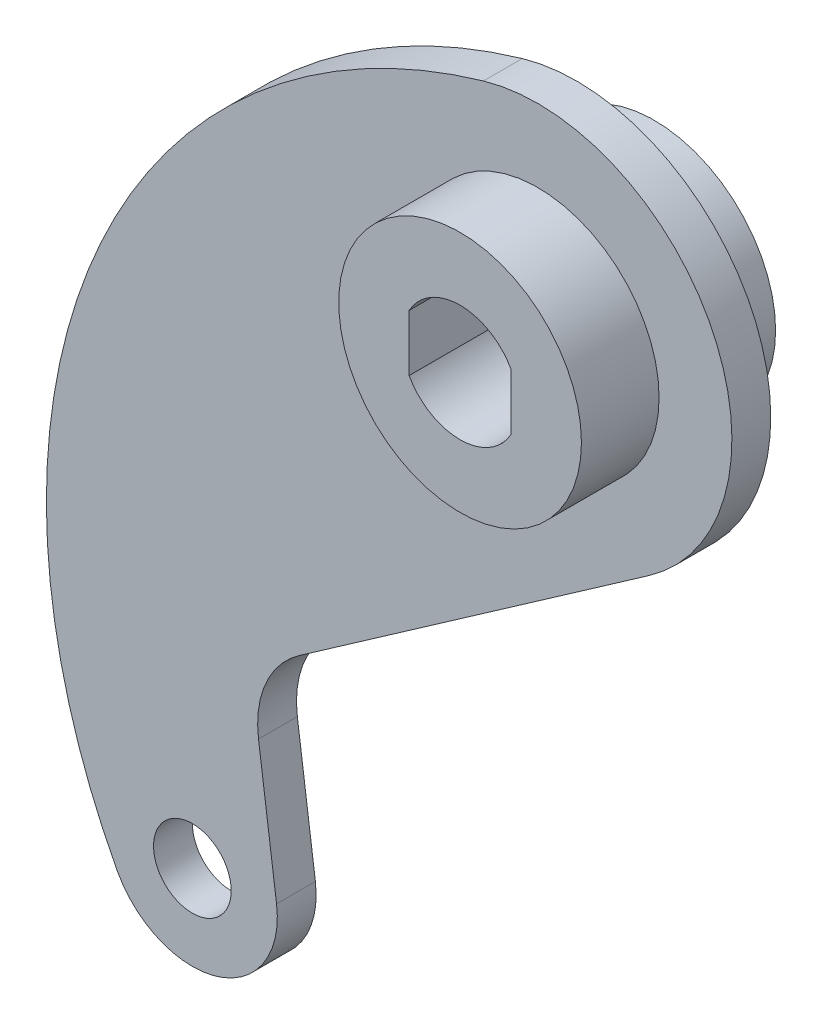
from build123d import *

# Parameters (mm, degrees)
SKETCH1_R           = 25
SKETCH1_R_2         = 12
BOSS_EXTRUDE1_DEPTH = 40
SKETCH3_R           = 25
SKETCH3_R_2         = 8
BOSS_EXTRUDE2_DEPTH = 8
FILLET1_R           = 20
BOSS_EXTRUDE3_START = -40
BOSS_EXTRUDE3_DEPTH = 40


with BuildPart() as part:
    # Sketch1 → Boss-Extrude1 (new body)
    with BuildSketch(Plane.XY):
        Circle(SKETCH1_R)
        Circle(SKETCH1_R_2, mode=Mode.SUBTRACT)
    extrude(amount=BOSS_EXTRUDE1_DEPTH)

    # Sketch4 → Boss-Extrude3 (add)
    with BuildSketch(Plane.XY.offset(40).offset(BOSS_EXTRUDE3_START)):
        with BuildLine():
            Line((-10.5, -5.809475019), (-10.5, 5.809475019))
            ThreePointArc((-10.5, 5.809475019), (-12, 0), (-10.5, -5.809475019))
        make_face()
        with BuildLine():
            Line((10.5, -5.809475019), (10.5, 5.809475019))
            ThreePointArc((10.5, 5.809475019), (12, 0), (10.5, -5.809475019))
        make_face()
    extrude(amount=BOSS_EXTRUDE3_DEPTH)


with BuildPart() as body_2:
    # Sketch3 → Boss-Extrude2 (new body)
    with BuildSketch(Plane.XY.offset(40)):
        with BuildLine():
            Line((-53.805427475, -129.712579959), (-59.154362217, -90.071832021))
            Line((-59.154362217, -90.071832021), (22.894902471, -32.799747573))
            ThreePointArc((22.894902471, -32.799747573), (36.079037262, 17.271452465), (-11.190557993, 38.402752659))
            ThreePointArc((-11.190557993, 38.402752659), (-91.382352121, -32.998777327), (-86.601681047, -140.265023248))
            ThreePointArc((-86.601681047, -140.265023248), (-65.78812655, -148.711641222), (-53.805427475, -129.712579959))
        make_face()
        Circle(SKETCH3_R, mode=Mode.SUBTRACT)
        with Locations((-71.148254698, -132.052738909)):
            Circle(SKETCH3_R_2, mode=Mode.SUBTRACT)
    extrude(amount=-BOSS_EXTRUDE2_DEPTH)

    # Fillet1
    fillet1_edges = [body_2.edges().sort_by_distance(p)[0] for p in [
        (-59.154362217, -90.071832021, 36),
    ]]
    fillet(fillet1_edges, radius=FILLET1_R)


with BuildPart() as body_2_1:
    # Body-Move/Copy1: moved
    add(body_2.part.moved(Location((0, 0, -16))))


solid = Compound([part.part, body_2_1.part])
